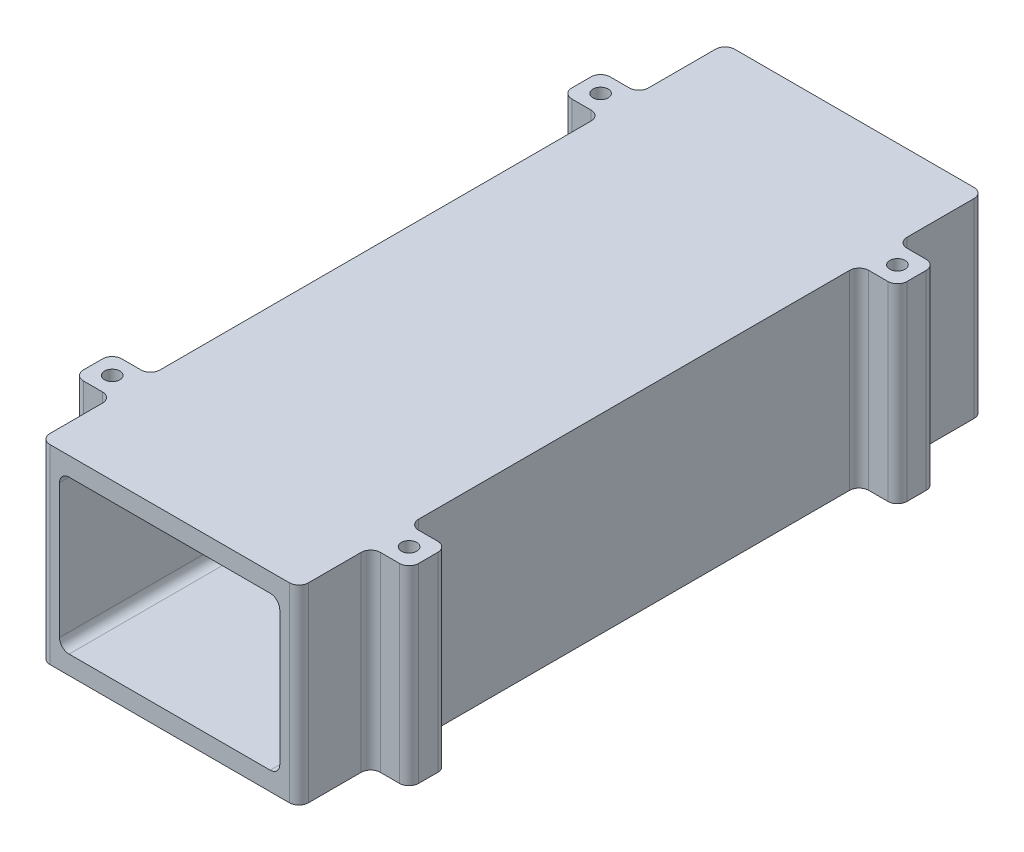
from build123d import *

# Parameters (mm, degrees)
SKETCH_1_W          = 54
SKETCH_1_H          = 39.8
SKETCH_1_W_2        = 46
SKETCH_1_H_2        = 32
EXTRUDE_1_DEPTH     = 143
SKETCH_3_W          = 54
SKETCH_3_H          = 39.8
EXTRUDE_2_DEPTH     = 3
SKETCH_4_W          = 8
SKETCH_4_H          = 8
SKETCH_4_R          = 1.6
EXTRUDE_3_DEPTH     = 39.8
FILLET_2_R          = 2
SKETCH_5_W          = 54
SKETCH_5_H          = 39.8
CUT_EXTRUDE_1_DEPTH = 3
FILLET_3_R          = 2


with BuildPart() as part:
    # 草图1 → 凸台-拉伸1 (new body)
    with BuildSketch(Plane.XY):
        Rectangle(SKETCH_1_W, SKETCH_1_H)
        Rectangle(SKETCH_1_W_2, SKETCH_1_H_2, mode=Mode.SUBTRACT)
    extrude(amount=EXTRUDE_1_DEPTH)

    # 草图3 → 凸台-拉伸2 (add)
    with BuildSketch(Plane(origin=(0, 0, 0), x_dir=(-1, 0, 0), z_dir=(0, 0, -1))):
        Rectangle(SKETCH_3_W, SKETCH_3_H)
    extrude(amount=EXTRUDE_2_DEPTH)

    # 草图4 → 凸台-拉伸3 (add)
    # profile 1 of 4: a face of its own
    with BuildSketch(Plane(origin=(0, 19.9, 0), x_dir=(1, 0, 0), z_dir=(0, 1, 0))):
        with Locations((-31, -121)):
            Rectangle(SKETCH_4_W, SKETCH_4_H)
        with Locations(Location((-31, -121, 0), (0, 0, 270))):
            Circle(SKETCH_4_R, mode=Mode.SUBTRACT)
    # profile 2 of 4: a face of its own
    with BuildSketch(Plane(origin=(0, 19.9, 0), x_dir=(1, 0, 0), z_dir=(0, 1, 0))):
        with Locations((31, -121)):
            Rectangle(SKETCH_4_W, SKETCH_4_H)
        with Locations(Location((31, -121, 0), (0, 0, 270))):
            Circle(SKETCH_4_R, mode=Mode.SUBTRACT)
    # profile 3 of 4: a face of its own
    with BuildSketch(Plane(origin=(0, 19.9, 0), x_dir=(1, 0, 0), z_dir=(0, 1, 0))):
        with Locations((31, -19)):
            Rectangle(SKETCH_4_W, SKETCH_4_H)
        with Locations(Location((31, -19, 0), (0, 0, 270))):
            Circle(SKETCH_4_R, mode=Mode.SUBTRACT)
    # profile 4 of 4: a face of its own
    with BuildSketch(Plane(origin=(0, 19.9, 0), x_dir=(1, 0, 0), z_dir=(0, 1, 0))):
        with Locations((-31, -19)):
            Rectangle(SKETCH_4_W, SKETCH_4_H)
        with Locations(Location((-31, -19, 0), (0, 0, 270))):
            Circle(SKETCH_4_R, mode=Mode.SUBTRACT)
    extrude(amount=-EXTRUDE_3_DEPTH)

    # 圆角2
    fillet_2_edges = [part.edges().sort_by_distance(p)[0] for p in [
        (23, -16, 71.5),
        (23, 16, 71.5),
        (-23, 16, 71.5),
        (-23, -16, 71.5),
    ]]
    fillet(fillet_2_edges, radius=FILLET_2_R)

    # 草图5 → 切除-拉伸1 (cut)
    with BuildSketch(Plane.XY.offset(143)):
        Rectangle(SKETCH_5_W, SKETCH_5_H)
    extrude(amount=-CUT_EXTRUDE_1_DEPTH, mode=Mode.SUBTRACT)

    # 圆角3
    fillet_3_edges = [part.edges().sort_by_distance(p)[0] for p in [
        (-27, 0, 140),
        (27, 0, 140),
        (27, 0, -3),
        (-27, 0, -3),
        (27, 0, 125),
        (27, 0, 117),
        (35, 0, 117),
        (35, 0, 125),
        (-27, 0, 117),
        (-27, 0, 125),
        (-35, 0, 125),
        (-35, 0, 117),
        (27, 0, 23),
        (27, 0, 15),
        (35, 0, 15),
        (35, 0, 23),
        (-35, 0, 15),
        (-27, 0, 15),
        (-27, 0, 23),
        (-35, 0, 23),
    ]]
    fillet(fillet_3_edges, radius=FILLET_3_R)


solid = part.part
